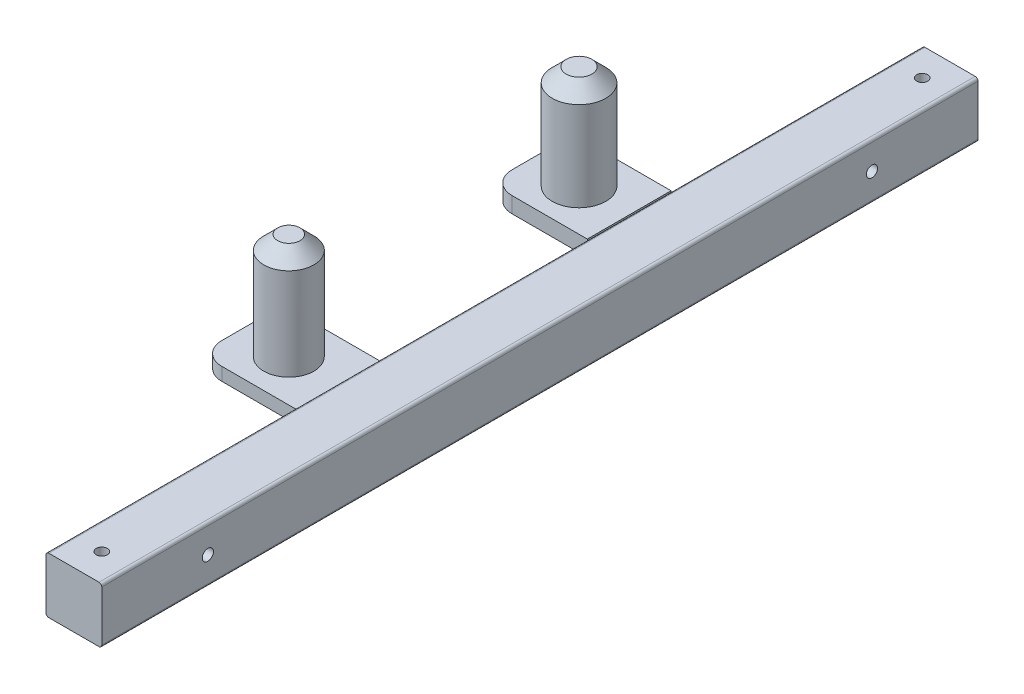
from build123d import *

# Parameters (mm, degrees)
SKETCH_1_W          = 20
SKETCH_1_H          = 20
EXTRUDE_1_DEPTH     = 314
SKETCH_2_R          = 2
CUT_EXTRUDE_1_DEPTH = 314
FILLET_1_R          = 1
SKETCH_3_R          = 2
CUT_EXTRUDE_2_DEPTH = 20
SKETCH_4_W          = 30
SKETCH_4_H          = 5.661352718
SKETCH_4_H_2        = 4.661352718
EXTRUDE_2_DEPTH     = 35
SKETCH_5_R          = 8.993195823
SKETCH_5_R_2        = 9.597903515
EXTRUDE_3_DEPTH     = 38
FILLET_2_R          = 8
CHAMFER_1_SIZE      = 5


with BuildPart() as part:
    # 草图1 → 凸台-拉伸1 (new body)
    with BuildSketch(Plane.XY):
        with Locations((10, 10)):
            Rectangle(SKETCH_1_W, SKETCH_1_H)
    extrude(amount=EXTRUDE_1_DEPTH)

    # 草图2 → 切除-拉伸1 (cut)
    with BuildSketch(Plane(origin=(0, 20, 0), x_dir=(1, 0, 0), z_dir=(0, 1, 0))):
        with Locations(Location((10, -10, 0), (0, 0, 270))):
            Circle(SKETCH_2_R)
        with Locations(Location((10, -304, 0), (0, 0, 270))):
            Circle(SKETCH_2_R)
    extrude(amount=-CUT_EXTRUDE_1_DEPTH, mode=Mode.SUBTRACT)

    # 圆角1
    fillet_1_edges = [part.edges().sort_by_distance(p)[0] for p in [
        (0, 20, 157),
        (20, 20, 157),
        (20, 0, 157),
        (0, 0, 157),
    ]]
    fillet(fillet_1_edges, radius=FILLET_1_R)

    # 草图3 → 切除-拉伸2 (cut)
    with BuildSketch(Plane.ZY):
        with Locations((276, 10)):
            Circle(SKETCH_3_R)
        with Locations((38, 10)):
            Circle(SKETCH_3_R)
    extrude(amount=-CUT_EXTRUDE_2_DEPTH, mode=Mode.SUBTRACT)

    # 草图4 → 凸台-拉伸2 (add)
    with BuildSketch(Plane.ZY):
        with Locations((105, 17.169323641)):
            Rectangle(SKETCH_4_W, SKETCH_4_H)
        with Locations((209, 16.669323641)):
            Rectangle(SKETCH_4_W, SKETCH_4_H_2)
    extrude(amount=EXTRUDE_2_DEPTH)

    # 草图5 → 凸台-拉伸3 (add)
    with BuildSketch(Plane(origin=(0, 19, 0), x_dir=(1, 0, 0), z_dir=(0, 1, 0))):
        with Locations(Location((-17.978292209, -209, 0), (0, 0, 90))):
            Circle(SKETCH_5_R)
        with Locations(Location((-17.978292209, -105, 0), (0, 0, 90))):
            Circle(SKETCH_5_R_2)
    extrude(amount=EXTRUDE_3_DEPTH)

    # 圆角2
    fillet_2_edges = [part.edges().sort_by_distance(p)[0] for p in [
        (-35, 17.169323641, 90),
        (-35, 17.169323641, 120),
        (-35, 16.669323641, 224),
        (-35, 16.669323641, 194),
    ]]
    fillet(fillet_2_edges, radius=FILLET_2_R)

    # 倒角1
    chamfer_1_edges = [part.edges().sort_by_distance(p)[0] for p in [
        (-17.978292209, 57, 217.993195823),
        (-17.978292209, 57, 114.597903515),
    ]]
    chamfer(chamfer_1_edges, length=CHAMFER_1_SIZE)


solid = part.part
